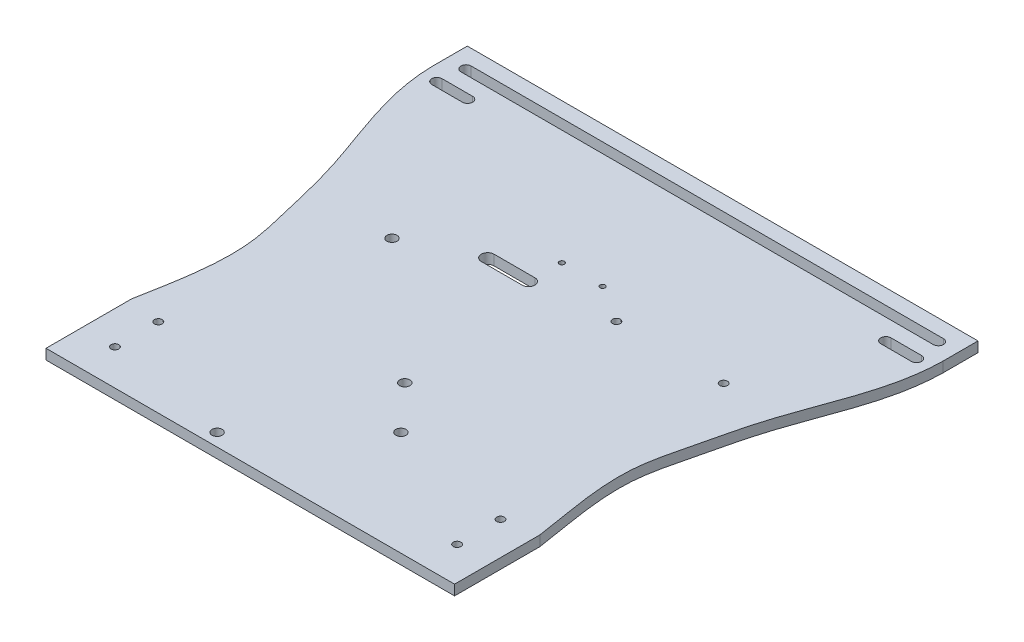
from build123d import *

# Parameters (mm, degrees)
ESQUISSE1_R        = 1.5
ESQUISSE1_R_2      = 1
ESQUISSE1_R_3      = 2
BOSS_EXTRU_1_DEPTH = 4


with BuildPart() as part:
    # Esquisse1 → Boss.-Extru.1 (new body)
    with BuildSketch(Plane(origin=(0, 0, 0), x_dir=(1, 0, 0), z_dir=(0, 1, 0))):
        with BuildLine():
            Line((20.099012054, -176.753119553), (180.099012054, -176.753119553))
            Line((180.099012054, -176.753119553), (180.099012054, -143.304210871))
            add(Edge.make_bspline(
                [(200.099012054, -5.402601665), (200.027324087, -10.863493838), (197.583796942, -30.094661829), (186.072485669, -54.954429671), (180.370262256, -81.651562253), (173.133805108, -108.569720083), (178.097171518, -129.349130809), (180.099012054, -143.304210871)],
                knots=[0.01165801, 0.01165801, 0.01165801, 0.01165801, 0.124408467, 0.420109799, 0.574806268, 0.697902863, 1, 1, 1, 1], degree=3))
            Line((200.099012054, -5.402601665), (200.099012054, 8.246880447))
            Line((200.099012054, 8.246880447), (0.099012054, 8.246880447))
            Line((0.099012054, 8.246880447), (0.099012054, -5.402601665))
            add(Edge.make_bspline(
                [(0.099012054, -5.402601665), (0.170700021, -10.863493838), (2.927056594, -30.094661829), (14.083581709, -54.954429671), (20.192714137, -81.651562253), (26.973296377, -108.569720083), (22.623790852, -129.349130809), (20.099012054, -143.304210871)],
                knots=[0.01165801, 0.01165801, 0.01165801, 0.01165801, 0.124408467, 0.420109799, 0.574806268, 0.697902863, 1, 1, 1, 1], degree=3))
            Line((20.099012054, -143.304210871), (20.099012054, -176.753119553))
        make_face()
        with Locations(Location((33.099012054, -145.753119553, 0), (0, 0, 270))):
            Circle(ESQUISSE1_R, mode=Mode.SUBTRACT)
        with Locations(Location((33.099012054, -162.753119553, 0), (0, 0, 270))):
            Circle(ESQUISSE1_R, mode=Mode.SUBTRACT)
        with Locations(Location((167.099012054, -162.753119553, 0), (0, 0, 90))):
            Circle(ESQUISSE1_R, mode=Mode.SUBTRACT)
        with Locations(Location((167.099012054, -145.753119553, 0), (0, 0, 90))):
            Circle(ESQUISSE1_R, mode=Mode.SUBTRACT)
        with Locations(Location((92.099012054, -46.753119553, 0), (0, 0, 270))):
            Circle(ESQUISSE1_R_2, mode=Mode.SUBTRACT)
        with Locations(Location((108.099012054, -46.753119553, 0), (0, 0, 270))):
            Circle(ESQUISSE1_R_2, mode=Mode.SUBTRACT)
        with Locations(Location((82.099012054, -171.753119553, 0), (0, 0, 270))):
            Circle(ESQUISSE1_R_3, mode=Mode.SUBTRACT)
        with Locations(Location((118.099012054, -135.753119553, 0), (0, 0, 270))):
            Circle(ESQUISSE1_R_3, mode=Mode.SUBTRACT)
        with Locations(Location((164.677408292, -55.946819434, 0), (0, 0, 270))):
            Circle(ESQUISSE1_R, mode=Mode.SUBTRACT)
        with Locations(Location((122.677408292, -55.946819434, 0), (0, 0, 270))):
            Circle(ESQUISSE1_R, mode=Mode.SUBTRACT)
        with Locations(Location((50.545382216, -71.701846064, 0), (0, 0, 270))):
            Circle(ESQUISSE1_R_3, mode=Mode.SUBTRACT)
        with Locations(Location((102.045382216, -118.201846064, 0), (0, 0, 270))):
            Circle(ESQUISSE1_R_3, mode=Mode.SUBTRACT)
        with BuildLine():
            Line((7.599012054, 2.246880447), (192.599012054, 2.246880447))
            ThreePointArc((192.599012054, 2.246880447), (194.599012054, 0.246880447), (192.599012054, -1.753119553))
            Line((192.599012054, -1.753119553), (7.599012054, -1.753119553))
            ThreePointArc((7.599012054, -1.753119553), (5.599012054, 0.246880447), (7.599012054, 2.246880447))
        make_face(mode=Mode.SUBTRACT)
        with BuildLine():
            Line((182, -7.753119553), (194, -7.753119553))
            ThreePointArc((194, -7.753119553), (196, -9.753119553), (194, -11.753119553))
            Line((194, -11.753119553), (182, -11.753119553))
            ThreePointArc((182, -11.753119553), (180, -9.753119553), (182, -7.753119553))
        make_face(mode=Mode.SUBTRACT)
        with BuildLine():
            Line((18.198024108, -7.753119553), (6.198024108, -7.753119553))
            ThreePointArc((6.198024108, -7.753119553), (4.198024108, -9.753119553), (6.198024108, -11.753119553))
            Line((6.198024108, -11.753119553), (18.198024108, -11.753119553))
            ThreePointArc((18.198024108, -11.753119553), (20.198024108, -9.753119553), (18.198024108, -7.753119553))
        make_face(mode=Mode.SUBTRACT)
        with BuildLine():
            Line((75.911540887, -57.098867648), (91.911540887, -57.098867648))
            ThreePointArc((91.911540887, -57.098867648), (94.411540887, -59.598867648), (91.911540887, -62.098867648))
            Line((91.911540887, -62.098867648), (75.911540887, -62.098867648))
            ThreePointArc((75.911540887, -62.098867648), (73.411540887, -59.598867648), (75.911540887, -57.098867648))
        make_face(mode=Mode.SUBTRACT)
    extrude(amount=BOSS_EXTRU_1_DEPTH)


solid = part.part
